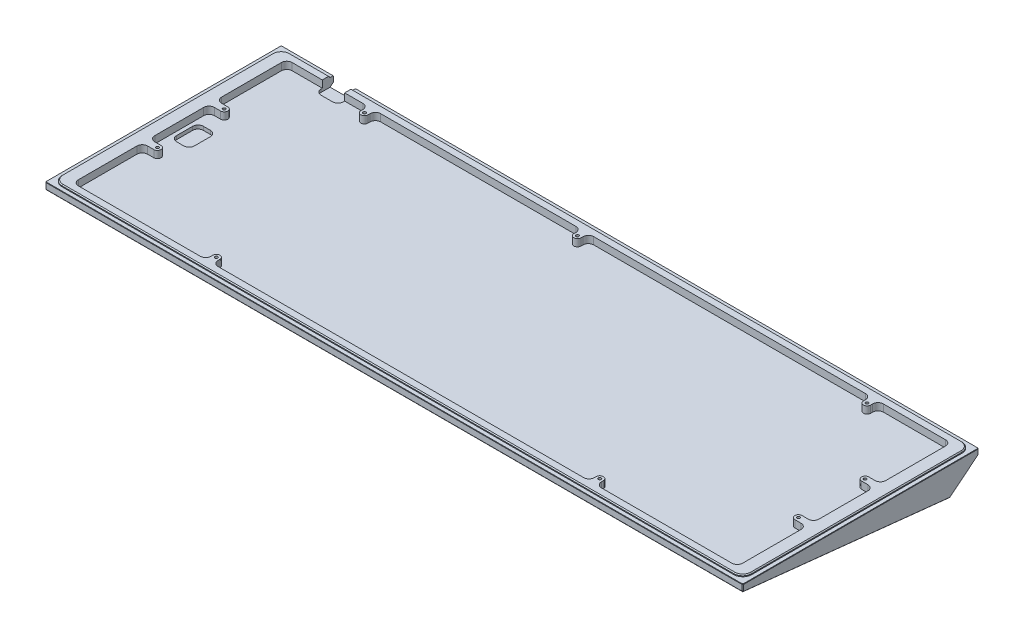
from build123d import *
from OCP.BRepFilletAPI import BRepFilletAPI_MakeChamfer

# Parameters (mm, degrees)
SKETCH1_W                 = 390
SKETCH1_H                 = 132
BOSS_EXTRUDE1_DEPTH       = 40
CUT_EXTRUDE1_DEPTH        = 414.67136715
CUT_EXTRUDE1_DEPTH_BACK   = 414.67136715
SKETCH3_W                 = 385.5
SKETCH3_H                 = 127.5
BOSS_EXTRUDE2_DEPTH       = 1
SKETCH4_R                 = 1
SKETCH4_W                 = 2
SKETCH4_H                 = 2
CUT_EXTRUDE2_DEPTH        = 1
SKETCH5_W                 = 371.3
SKETCH5_H                 = 119.475
CUT_EXTRUDE3_DEPTH        = 4
BOSS_EXTRUDE3_DEPTH       = 4
SKETCH7_W                 = 12.5
SKETCH7_H                 = 5.7
CUT_EXTRUDE4_DEPTH        = 10
M2X0_4_TAPPED_HOLE1_D     = 1.6
M2X0_4_TAPPED_HOLE1_DEPTH = 4
M2X0_4_TAPPED_HOLE1_TIP   = 0.480688495
SKETCH10_W                = 10
SKETCH10_H                = 15
CUT_EXTRUDE5_DEPTH        = 2
FILLET1_R                 = 3
FILLET2_R                 = 5
CHAMFER1_SIZE             = 0.5
CHAMFER1_SIZE2            = 0.561801899
SKETCH11_R                = 5.5
CUT_EXTRUDE6_DEPTH        = 0.1
CHAMFER2_SIZE             = 0.2


with BuildPart() as part:
    # Sketch1 → Boss-Extrude1 (new body)
    with BuildSketch(Plane(origin=(0, 0, 0), x_dir=(1, 0, 0), z_dir=(0, 1, 0))):
        with Locations((195, 66)):
            Rectangle(SKETCH1_W, SKETCH1_H)
    extrude(amount=BOSS_EXTRUDE1_DEPTH)

    # Sketch2 → Cut-Extrude1 (cut, two sides: drawn at the far end of the back side and taken through both)
    with BuildSketch(Plane.ZY.offset(-CUT_EXTRUDE1_DEPTH_BACK)):
        Polygon((282.518524232, 65.693893438), (0, 36), (-115.946336965, 23.813548921), (-132, 36.813548921), (-352.767517705, 215.587559807), (-483.238002963, -337.378287098), (152.048038973, -487.271953467), align=None)
    extrude(amount=CUT_EXTRUDE1_DEPTH + CUT_EXTRUDE1_DEPTH_BACK, mode=Mode.SUBTRACT)

    # Sketch3 → Boss-Extrude2 (add)
    with BuildSketch(Plane(origin=(0, 40, 0), x_dir=(1, 0, 0), z_dir=(0, 1, 0))):
        with Locations((195, 66)):
            Rectangle(SKETCH3_W, SKETCH3_H)
    extrude(amount=BOSS_EXTRUDE2_DEPTH)

    # Sketch4 → Cut-Extrude2 (cut)
    with BuildSketch(Plane(origin=(0, 35.606656813, -3.742410435), x_dir=(1, 0, 0), z_dir=(0, -0.9945218953682742, 0.10452846326764668))):
        with BuildLine():
            ThreePointArc((200.4, -57.941894447), (201.4, -56.941894447), (202.4, -57.941894447))
            Line((202.4, -57.941894447), (202.4, -47.441894447))
            ThreePointArc((202.4, -47.441894447), (201.4, -48.441894447), (200.4, -47.441894447))
            Line((200.4, -47.441894447), (200.4, -57.941894447))
        make_face()
        with Locations((204.9, -49.941894447)):
            Circle(SKETCH4_R)
        with BuildLine():
            ThreePointArc((203.9, -49.941894447), (204.9, -48.941894447), (205.9, -49.941894447))
            Line((205.9, -49.941894447), (205.9, -47.441894447))
            ThreePointArc((205.9, -47.441894447), (204.9, -48.441894447), (203.9, -47.441894447))
            Line((203.9, -47.441894447), (203.9, -49.941894447))
        make_face()
        with Locations((204.9, -47.441894447)):
            Circle(SKETCH4_R)
        with Locations((201.4, -47.441894447)):
            Circle(SKETCH4_R)
        with Locations((201.4, -57.941894447)):
            Circle(SKETCH4_R)
        with Locations(Location((201.4, -61.441894447, 0), (0, 0, 270))):
            Circle(SKETCH4_R)
        with Locations((196.9, -65.441894447)):
            Circle(SKETCH4_R)
        with BuildLine():
            ThreePointArc((195.9, -65.441894447), (196.9, -64.441894447), (197.9, -65.441894447))
            Line((197.9, -65.441894447), (197.9, -62.441894447))
            Line((197.9, -62.441894447), (195.9, -62.441894447))
            Line((195.9, -62.441894447), (195.9, -65.441894447))
        make_face()
        with Locations((196.9, -61.441894447)):
            Rectangle(SKETCH4_W, SKETCH4_H)
        with Locations((193.9, -61.441894447)):
            Circle(SKETCH4_R)
        with BuildLine():
            Line((193.9, -62.441894447), (195.9, -62.441894447))
            Line((195.9, -62.441894447), (195.9, -60.441894447))
            Line((195.9, -60.441894447), (193.9, -60.441894447))
            ThreePointArc((193.9, -60.441894447), (194.607106781, -60.734787666), (194.9, -61.441894447))
            ThreePointArc((194.9, -61.441894447), (194.607106781, -62.149001228), (193.9, -62.441894447))
        make_face()
        with BuildLine():
            Line((195.9, -60.441894447), (197.9, -60.441894447))
            Line((197.9, -60.441894447), (197.9, -51.441894447))
            ThreePointArc((197.9, -51.441894447), (196.9, -52.441894447), (195.9, -51.441894447))
            Line((195.9, -51.441894447), (195.9, -60.441894447))
        make_face()
        with Locations((196.9, -51.441894447)):
            Circle(SKETCH4_R)
        with Locations((192.1, -51.941894447)):
            Circle(SKETCH4_R)
        with BuildLine():
            ThreePointArc((191.1, -57.941894447), (192.1, -56.941894447), (193.1, -57.941894447))
            Line((193.1, -57.941894447), (193.1, -51.941894447))
            ThreePointArc((193.1, -51.941894447), (192.1, -52.941894447), (191.1, -51.941894447))
            Line((191.1, -51.941894447), (191.1, -57.941894447))
        make_face()
        with Locations((192.1, -57.941894447)):
            Circle(SKETCH4_R)
        with BuildLine():
            ThreePointArc((187.6, -57.941894447), (188.6, -56.941894447), (189.6, -57.941894447))
            Line((189.6, -57.941894447), (189.6, -51.941894447))
            ThreePointArc((189.6, -51.941894447), (188.6, -52.941894447), (187.6, -51.941894447))
            Line((187.6, -51.941894447), (187.6, -57.941894447))
        make_face()
        with Locations((188.6, -57.941894447)):
            Circle(SKETCH4_R)
        with Locations((188.6, -51.941894447)):
            Circle(SKETCH4_R)
        with Locations((185.1, -51.941894447)):
            Circle(SKETCH4_R)
        with BuildLine():
            ThreePointArc((184.1, -57.941894447), (185.1, -56.941894447), (186.1, -57.941894447))
            Line((186.1, -57.941894447), (186.1, -51.941894447))
            ThreePointArc((186.1, -51.941894447), (185.1, -52.941894447), (184.1, -51.941894447))
            Line((184.1, -51.941894447), (184.1, -57.941894447))
        make_face()
        with Locations((185.1, -57.941894447)):
            Circle(SKETCH4_R)
    extrude(amount=-CUT_EXTRUDE2_DEPTH, mode=Mode.SUBTRACT)

    # Sketch5 → Cut-Extrude3 (cut)
    with BuildSketch(Plane(origin=(0, 41, 0), x_dir=(1, 0, 0), z_dir=(0, 1, 0))):
        with Locations((195, 66)):
            Rectangle(SKETCH5_W, SKETCH5_H)
    extrude(amount=-CUT_EXTRUDE3_DEPTH, mode=Mode.SUBTRACT)

    # Sketch6 → Boss-Extrude3 (add)
    with BuildSketch(Plane(origin=(0, 37, 0), x_dir=(1, 0, 0), z_dir=(0, 1, 0))):
        with BuildLine():
            Line((9.35, 86.288), (9.35, 82.288))
            Line((9.35, 82.288), (15.85, 82.288))
            ThreePointArc((15.85, 82.288), (13.85, 84.288), (15.85, 86.288))
            Line((15.85, 86.288), (9.35, 86.288))
        make_face()
        with BuildLine():
            ThreePointArc((15.85, 86.288), (13.85, 84.288), (15.85, 82.288))
            Line((15.85, 82.288), (15.85, 86.288))
        make_face()
        with BuildLine():
            Line((15.85, 86.288), (15.85, 82.288))
            ThreePointArc((15.85, 82.288), (17.264213562, 82.873786438), (17.85, 84.288))
            ThreePointArc((17.85, 84.288), (17.264213562, 85.702213562), (15.85, 86.288))
        make_face()
        with BuildLine():
            ThreePointArc((15.85, 44.95), (13.85, 46.95), (15.85, 48.95))
            Line((15.85, 48.95), (9.35, 48.95))
            Line((9.35, 48.95), (9.35, 44.95))
            Line((9.35, 44.95), (15.85, 44.95))
        make_face()
        with BuildLine():
            ThreePointArc((17.85, 46.95), (17.264213562, 48.364213562), (15.85, 48.95))
            Line((15.85, 48.95), (15.85, 44.95))
            ThreePointArc((15.85, 44.95), (17.264213562, 45.535786438), (17.85, 46.95))
        make_face()
        with BuildLine():
            Line((15.85, 44.95), (15.85, 48.95))
            ThreePointArc((15.85, 48.95), (13.85, 46.95), (15.85, 44.95))
        make_face()
        with BuildLine():
            ThreePointArc((58.8875, 121.625), (56.8875, 123.625), (54.8875, 121.625))
            Line((54.8875, 121.625), (58.8875, 121.625))
        make_face()
        with BuildLine():
            Line((58.8875, 121.625), (54.8875, 121.625))
            ThreePointArc((54.8875, 121.625), (56.8875, 119.625), (58.8875, 121.625))
        make_face()
        with BuildLine():
            Line((58.8875, 125.7375), (54.8875, 125.7375))
            Line((54.8875, 125.7375), (54.8875, 121.625))
            ThreePointArc((54.8875, 121.625), (56.8875, 123.625), (58.8875, 121.625))
            Line((58.8875, 121.625), (58.8875, 125.7375))
        make_face()
        with BuildLine():
            ThreePointArc((177.95, 121.625), (175.95, 123.625), (173.95, 121.625))
            Line((173.95, 121.625), (177.95, 121.625))
        make_face()
        with BuildLine():
            Line((177.95, 121.625), (173.95, 121.625))
            ThreePointArc((173.95, 121.625), (175.95, 119.625), (177.95, 121.625))
        make_face()
        with BuildLine():
            Line((177.95, 125.7375), (173.95, 125.7375))
            Line((173.95, 125.7375), (173.95, 121.625))
            ThreePointArc((173.95, 121.625), (175.95, 123.625), (177.95, 121.625))
            Line((177.95, 121.625), (177.95, 125.7375))
        make_face()
        with BuildLine():
            ThreePointArc((339.875, 121.625), (337.875, 123.625), (335.875, 121.625))
            Line((335.875, 121.625), (339.875, 121.625))
        make_face()
        with BuildLine():
            Line((339.875, 121.625), (335.875, 121.625))
            ThreePointArc((335.875, 121.625), (337.875, 119.625), (339.875, 121.625))
        make_face()
        with BuildLine():
            Line((339.875, 125.7375), (335.875, 125.7375))
            Line((335.875, 125.7375), (335.875, 121.625))
            ThreePointArc((335.875, 121.625), (337.875, 123.625), (339.875, 121.625))
            Line((339.875, 121.625), (339.875, 125.7375))
        make_face()
        with BuildLine():
            ThreePointArc((374.15, 86.288), (372.15, 84.288), (374.15, 82.288))
            Line((374.15, 82.288), (374.15, 86.288))
        make_face()
        with BuildLine():
            Line((374.15, 86.288), (374.15, 82.288))
            ThreePointArc((374.15, 82.288), (375.564213562, 82.873786438), (376.15, 84.288))
            ThreePointArc((376.15, 84.288), (375.564213562, 85.702213562), (374.15, 86.288))
        make_face()
        with BuildLine():
            Line((374.15, 82.288), (380.65, 82.288))
            Line((380.65, 82.288), (380.65, 86.288))
            Line((380.65, 86.288), (374.15, 86.288))
            ThreePointArc((374.15, 86.288), (375.564213562, 85.702213562), (376.15, 84.288))
            ThreePointArc((376.15, 84.288), (375.564213562, 82.873786438), (374.15, 82.288))
        make_face()
        with BuildLine():
            ThreePointArc((374.15, 48.95), (372.15, 46.95), (374.15, 44.95))
            Line((374.15, 44.95), (374.15, 48.95))
        make_face()
        with BuildLine():
            Line((374.15, 48.95), (374.15, 44.95))
            ThreePointArc((374.15, 44.95), (375.564213562, 45.535786438), (376.15, 46.95))
            ThreePointArc((376.15, 46.95), (375.564213562, 48.364213562), (374.15, 48.95))
        make_face()
        with BuildLine():
            Line((374.15, 44.95), (380.65, 44.95))
            Line((380.65, 44.95), (380.65, 48.95))
            Line((380.65, 48.95), (374.15, 48.95))
            ThreePointArc((374.15, 48.95), (375.564213562, 48.364213562), (376.15, 46.95))
            ThreePointArc((376.15, 46.95), (375.564213562, 45.535786438), (374.15, 44.95))
        make_face()
        with BuildLine():
            Line((297.775, 10.275), (297.775, 6.2625))
            Line((297.775, 6.2625), (301.775, 6.2625))
            Line((301.775, 6.2625), (301.775, 10.275))
            ThreePointArc((301.775, 10.275), (299.775, 8.275), (297.775, 10.275))
        make_face()
        with BuildLine():
            ThreePointArc((301.775, 10.275), (299.775, 12.275), (297.775, 10.275))
            Line((297.775, 10.275), (301.775, 10.275))
        make_face()
        with BuildLine():
            Line((301.775, 10.275), (297.775, 10.275))
            ThreePointArc((297.775, 10.275), (299.775, 8.275), (301.775, 10.275))
        make_face()
        with BuildLine():
            Line((83.4625, 10.275), (83.4625, 6.2625))
            Line((83.4625, 6.2625), (87.4625, 6.2625))
            Line((87.4625, 6.2625), (87.4625, 10.275))
            ThreePointArc((87.4625, 10.275), (85.4625, 8.275), (83.4625, 10.275))
        make_face()
        with BuildLine():
            ThreePointArc((87.4625, 10.275), (85.4625, 12.275), (83.4625, 10.275))
            Line((83.4625, 10.275), (87.4625, 10.275))
        make_face()
        with BuildLine():
            Line((87.4625, 10.275), (83.4625, 10.275))
            ThreePointArc((83.4625, 10.275), (85.4625, 8.275), (87.4625, 10.275))
        make_face()
    extrude(amount=BOSS_EXTRUDE3_DEPTH)

    # Sketch7 → Cut-Extrude4 (cut)
    with BuildSketch(Plane(origin=(0, 0, -132), x_dir=(-1, 0, 0), z_dir=(0, 0, -1))):
        with Locations((-35.45625, 38.15)):
            Rectangle(SKETCH7_W, SKETCH7_H)
    extrude(amount=-CUT_EXTRUDE4_DEPTH, mode=Mode.SUBTRACT)

    # M2x0.4 Tapped Hole1
    with Locations(Plane(origin=(15.85, 41, -84.288), x_dir=(0, 0, 1), z_dir=(0, 1, 0))):
        with Locations((0, 0), (37.338, 0), (74.013, 69.6125), (-37.337, 41.0375), (-37.337, 160.1), (74.013, 283.925), (37.338, 358.3), (0, 358.3), (-37.337, 322.025)):
            Hole(M2X0_4_TAPPED_HOLE1_D / 2, depth=M2X0_4_TAPPED_HOLE1_DEPTH)
            with Locations((0, 0, -(M2X0_4_TAPPED_HOLE1_DEPTH + M2X0_4_TAPPED_HOLE1_TIP / 2))):  # 118° drill point
                Cone(0, M2X0_4_TAPPED_HOLE1_D / 2, M2X0_4_TAPPED_HOLE1_TIP, mode=Mode.SUBTRACT)

    # Sketch10 → Cut-Extrude5 (cut)
    with BuildSketch(Plane(origin=(0, 37, 0), x_dir=(1, 0, 0), z_dir=(0, 1, 0))):
        with Locations((16.40625, 66.5715)):
            Rectangle(SKETCH10_W, SKETCH10_H)
    extrude(amount=-CUT_EXTRUDE5_DEPTH, mode=Mode.SUBTRACT)

    # Fillet1
    fillet1_edges = [part.edges().sort_by_distance(p)[0] for p in [
        (9.35, 39, -6.2625),
        (9.35, 39, -125.7375),
        (380.65, 39, -125.7375),
        (380.65, 39, -6.2625),
        (9.35, 39, -82.288),
        (9.35, 39, -86.288),
        (9.35, 39, -44.95),
        (9.35, 39, -48.95),
        (54.8875, 39, -125.7375),
        (58.8875, 39, -125.7375),
        (173.95, 39, -125.7375),
        (177.95, 39, -125.7375),
        (335.875, 39, -125.7375),
        (339.875, 39, -125.7375),
        (380.65, 39, -86.288),
        (380.65, 39, -82.288),
        (380.65, 39, -48.95),
        (380.65, 39, -44.95),
        (301.775, 39, -6.2625),
        (297.775, 39, -6.2625),
        (87.4625, 39, -6.2625),
        (83.4625, 39, -6.2625),
        (41.70625, 36.15, -122),
        (29.20625, 36.15, -122),
        (11.40625, 36, -59.0715),
        (11.40625, 36, -74.0715),
        (21.40625, 36, -74.0715),
        (21.40625, 36, -59.0715),
    ]]
    fillet(fillet1_edges, radius=FILLET1_R)

    # Fillet2
    fillet2_edges = [part.edges().sort_by_distance(p)[0] for p in [
        (387.75, 40.5, -2.25),
        (387.75, 40.5, -129.75),
        (2.25, 40.5, -129.75),
        (2.25, 40.5, -2.25),
    ]]
    fillet(fillet2_edges, radius=FILLET2_R)

    # Chamfer1: one chamfer whose edges measure the first distance from different faces: ONE call of the kernel's chamfer builder (chamfer() names one face for all edges)
    chamfer1_edges_1 = [part.edges().sort_by_distance(p)[0] for p in [
        (390, 29.906774461, -57.973168483),
        (0, 29.906774461, -57.973168483),
        (0, 30.313548921, -123.973168483),
        (390, 30.313548921, -123.973168483),
        (18.228125, 41, -129.75),
        (212.228125, 41, -129.75),
        (387.75, 41, -66),
        (2.25, 41, -66),
        (195, 41, -2.25),
        (3.714466094, 41, -128.285533906),
        (3.714466094, 41, -3.714466094),
        (386.285533906, 41, -3.714466094),
        (386.285533906, 41, -128.285533906),
        (0, 38.406774461, -132),
        (390, 38.406774461, -132),
        (390, 38, 0),
        (0, 38, 0),
    ]]
    chamfer1_edges_2 = [part.edges().sort_by_distance(p)[0] for p in [
        (195, 36, 0),
    ]]
    chamfer1_side_2 = [part.faces().sort_by_distance(p)[0] for p in [
        (194.999539806, 29.907025481, -57.970780186),
    ]]
    chamfer1 = BRepFilletAPI_MakeChamfer(part.part.solid().wrapped)
    for e in chamfer1_edges_1:
        chamfer1.Add(CHAMFER1_SIZE, e.wrapped)
    for e in chamfer1_edges_2:
        chamfer1.Add(CHAMFER1_SIZE, CHAMFER1_SIZE2, e.wrapped, chamfer1_side_2[0].wrapped)  # the first distance lies on this face
    add(Compound.cast(chamfer1.Shape()), mode=Mode.REPLACE)

    # Sketch11 → Cut-Extrude6 (cut)
    with BuildSketch(Plane(origin=(0, 35.606656813, -3.742410435), x_dir=(1, 0, 0), z_dir=(0, -0.9945218953682742, 0.10452846326764668))):
        with Locations(Location((379.5, -102.821977126, 0), (0, 0, 270))):
            Circle(SKETCH11_R)
        with Locations(Location((379.5, -6.736975322, 0), (0, 0, 270))):
            Circle(SKETCH11_R)
        with Locations(Location((10, -102.821977126, 0), (0, 0, 270))):
            Circle(SKETCH11_R)
        with Locations(Location((10, -6.736975322, 0), (0, 0, 270))):
            Circle(SKETCH11_R)
    extrude(amount=-CUT_EXTRUDE6_DEPTH, mode=Mode.SUBTRACT)

    # Chamfer2
    chamfer2_edges = [part.edges().sort_by_distance(p)[0] for p in [
        (14.853125, 40, -132),
        (195, 40, 0),
        (0, 40, -66),
        (215.603125, 40, -132),
        (390, 40, -66),
        (389.75, 40, -131.75),
        (389.75, 40, -0.25),
        (0.25, 40, -131.75),
        (0.25, 40, -0.25),
    ]]
    chamfer(chamfer2_edges, length=CHAMFER2_SIZE)


solid = part.part
